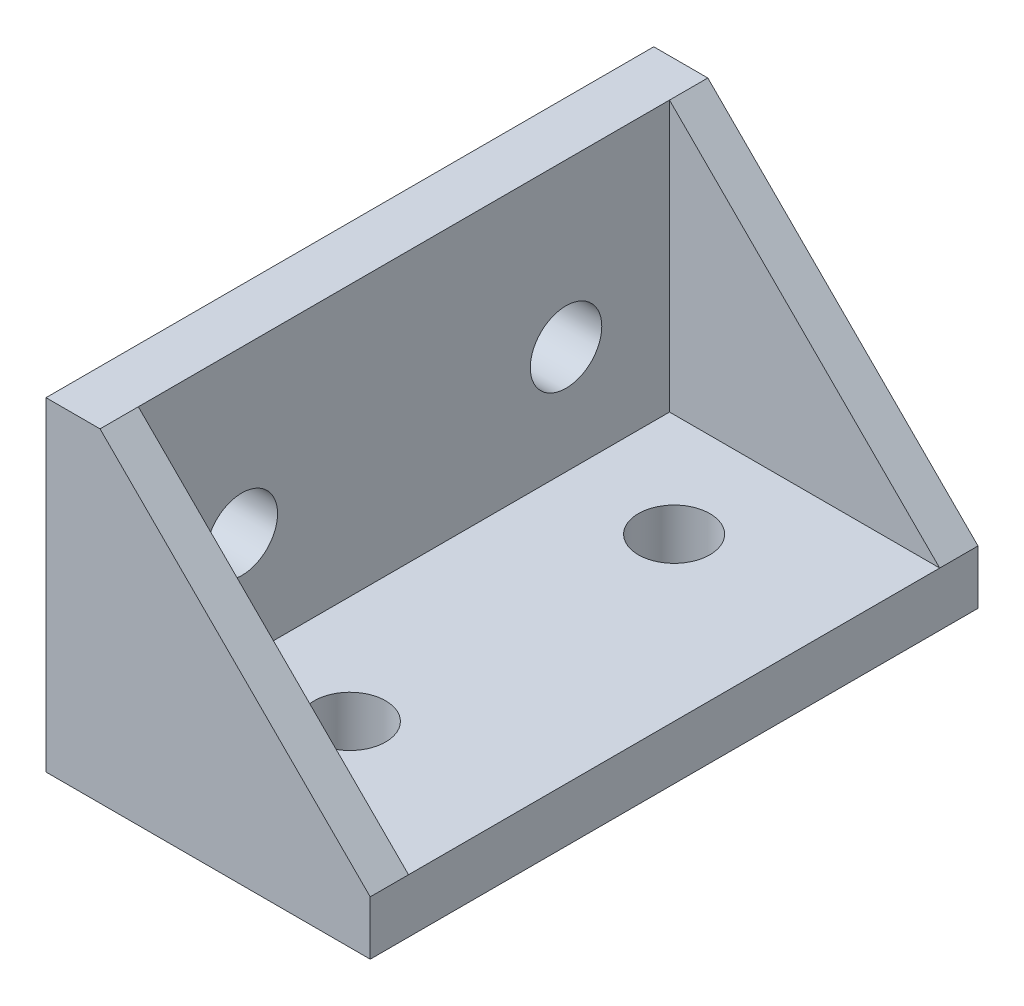
from build123d import *

# Parameters (mm, degrees)
BODY_DEPTH   = 71.42
POCKET_DEPTH = 62.42
SKETCH3_R    = 4.2
HOLESX_DEPTH = 6.35
SKETCH4_R    = 4.2
HOLESY_DEPTH = 6.35


with BuildPart() as part:
    # Sketch1 → Body (new body)
    with BuildSketch(Plane.XY.offset(-35.71)):
        Polygon((0, 0), (38.1, 0), (38.1, 6.35), (6.35, 38.1), (0, 38.1), align=None)
    extrude(amount=BODY_DEPTH)

    # Sketch2 → Pocket (cut)
    with BuildSketch(Plane.XY.offset(31.21)):
        Polygon((6.35, 6.35), (48.1, 6.35), (6.35, 48.1), align=None)
    extrude(amount=-POCKET_DEPTH, mode=Mode.SUBTRACT)

    # Sketch3 → HolesX (cut)
    with BuildSketch(Plane(origin=(0, 6.35, 0), x_dir=(1, 0, 0), z_dir=(0, 1, 0))):
        with Locations(Location((19.05, 19.05, 0), (0, 0, 270))):
            Circle(SKETCH3_R)
        with Locations(Location((19.05, -19.05, 0), (0, 0, 270))):
            Circle(SKETCH3_R)
    extrude(amount=-HOLESX_DEPTH, mode=Mode.SUBTRACT)

    # Sketch4 → HolesY (cut)
    with BuildSketch(Plane(origin=(6.35, 0, 0), x_dir=(0, 0, -1), z_dir=(1, 0, 0))):
        with Locations((19.05, 19.05)):
            Circle(SKETCH4_R)
        with Locations((-19.05, 19.05)):
            Circle(SKETCH4_R)
    extrude(amount=-HOLESY_DEPTH, mode=Mode.SUBTRACT)


solid = part.part
